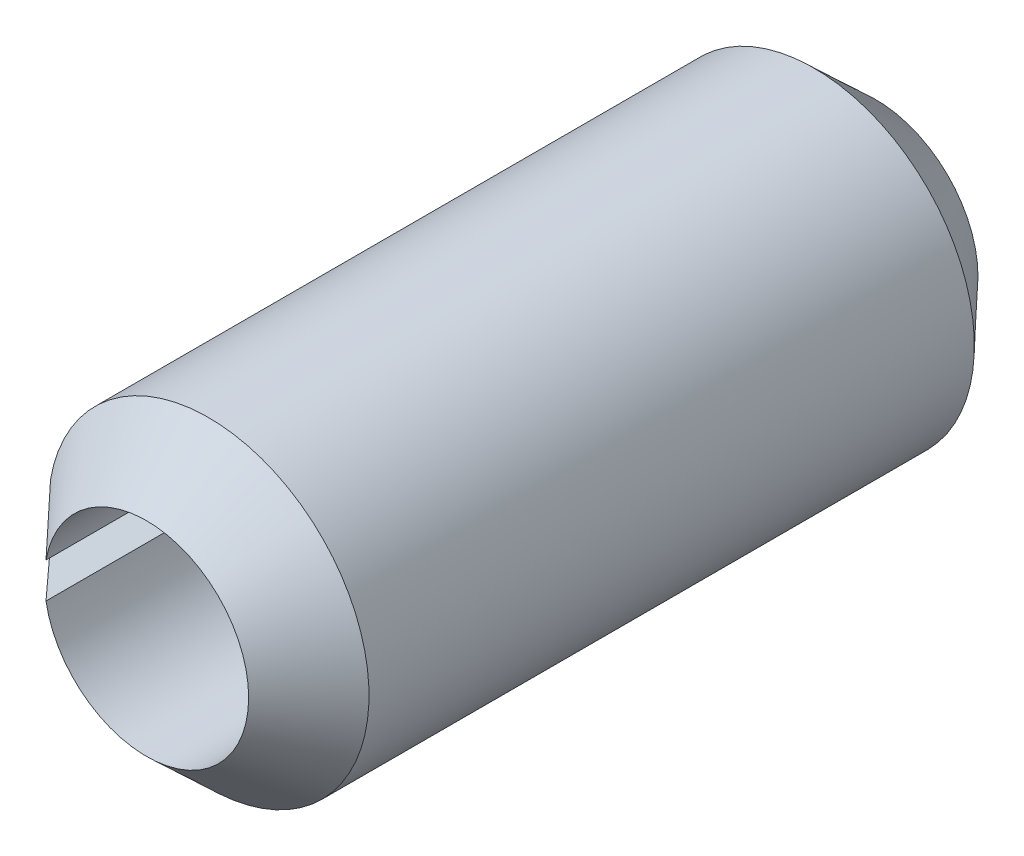
from build123d import *

# Parameters (mm, degrees)
EXTRUDE1_DEPTH = 5


with BuildPart() as part:
    # Sketch1 → Extrude1 (new, symmetric)
    with BuildSketch(Plane.XY):
        with BuildLine():
            Line((-2.166577057, 0.382025991), (-1.378730854, 0.243107449))
            ThreePointArc((-1.378730854, 0.243107449), (1.4, 0), (-1.378730854, -0.243107449))
            Line((-1.378730854, -0.243107449), (-2.166577057, -0.382025991))
            ThreePointArc((-2.166577057, -0.382025991), (2.2, 0), (-2.166577057, 0.382025991))
        make_face()
    extrude(amount=EXTRUDE1_DEPTH, both=True)

    # Sketch2 → Cut-Revolve1 (revolve, cut)
    with BuildSketch(Plane(origin=(0, 0, 0), x_dir=(0, 0, -1), z_dir=(1, 0, 0))):
        Polygon((5, 2.2), (5, 1.4), (4.15, 2.2), align=None)
        Polygon((-4.15, 2.2), (-5, 2.2), (-5, 1.4), align=None)
    revolve(axis=Axis((0, 0, -5), (0, 0, 1)), mode=Mode.SUBTRACT)


solid = part.part
